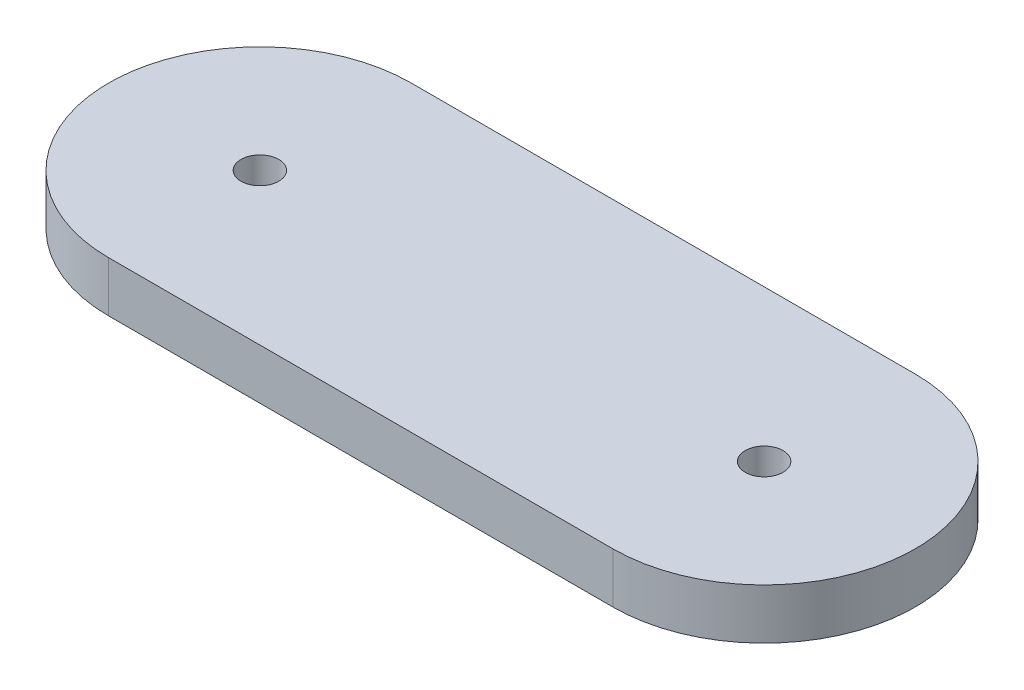
from build123d import *

# Parameters (mm, degrees)
SKETCH1_R           = 38.1
SKETCH1_W           = 127
SKETCH1_H           = 76.2
BOSS_EXTRUDE1_DEPTH = 12.7
SKETCH2_R           = 4.7625
CUT_EXTRUDE2_DEPTH  = 113.430244289


with BuildPart() as part:
    # Sketch1 → Boss-Extrude1 (new body)
    with BuildSketch(Plane(origin=(0, 0, 0), x_dir=(1, 0, 0), z_dir=(0, 1, 0))):
        with Locations((-66.912665097, 0)):
            Circle(SKETCH1_R)
        with Locations((60.087334903, 0)):
            Circle(SKETCH1_R)
        with Locations((-3.412665097, 0)):
            Rectangle(SKETCH1_W, SKETCH1_H)
    extrude(amount=BOSS_EXTRUDE1_DEPTH)

    # Sketch2 → Cut-Extrude2 (cut, through all)
    with BuildSketch(Plane(origin=(0, 12.7, 0), x_dir=(1, 0, 0), z_dir=(0, 1, 0))):
        with Locations(Location((-66.912665097, 0, 0), (0, 0, 270))):
            Circle(SKETCH2_R)
        with Locations(Location((60.087334903, 0, 0), (0, 0, 270))):
            Circle(SKETCH2_R)
    extrude(amount=-CUT_EXTRUDE2_DEPTH, mode=Mode.SUBTRACT)


solid = part.part
